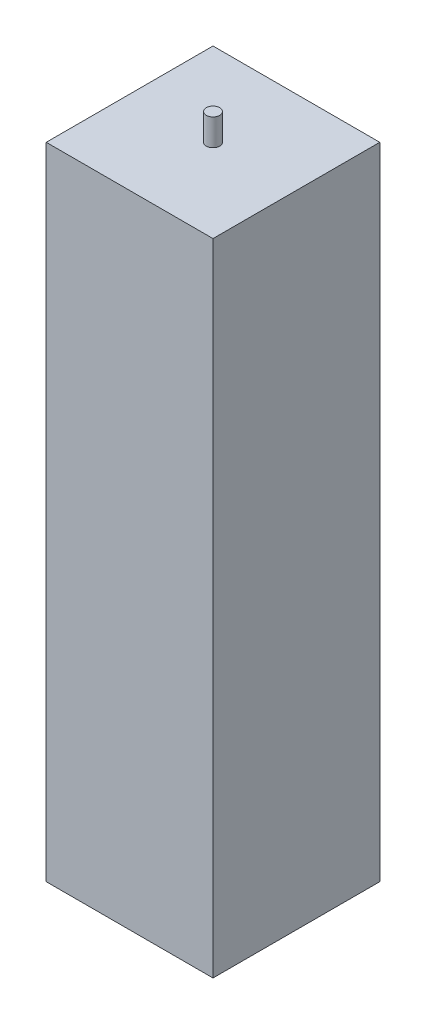
from build123d import *

# Parameters (mm, degrees)
SKETCH_1_W           = 12.5
SKETCH_1_H           = 48
EXTRUDE_1_DEPTH      = 12.5
EXTRUDE_2_DEPTH      = 2
EXTRUDE_2_DEPTH_BACK = 49.5
SKETCH_2_R           = 0.5


with BuildPart() as part:
    # 草图1 → 凸台-拉伸1 (new body)
    with BuildSketch(Plane.XY):
        Rectangle(SKETCH_1_W, SKETCH_1_H)
    extrude(amount=EXTRUDE_1_DEPTH)

    # 草图2 → 凸台-拉伸2 (add, two sides: drawn at the far end of the back side and taken through both)
    with BuildSketch(Plane(origin=(0, 24, 0), x_dir=(1, 0, 0), z_dir=(0, 1, 0)).offset(-EXTRUDE_2_DEPTH_BACK)):
        with Locations(Location((0, -6.25, 0), (0, 0, 270))):
            Circle(SKETCH_2_R)
    extrude(amount=EXTRUDE_2_DEPTH + EXTRUDE_2_DEPTH_BACK)


solid = part.part
